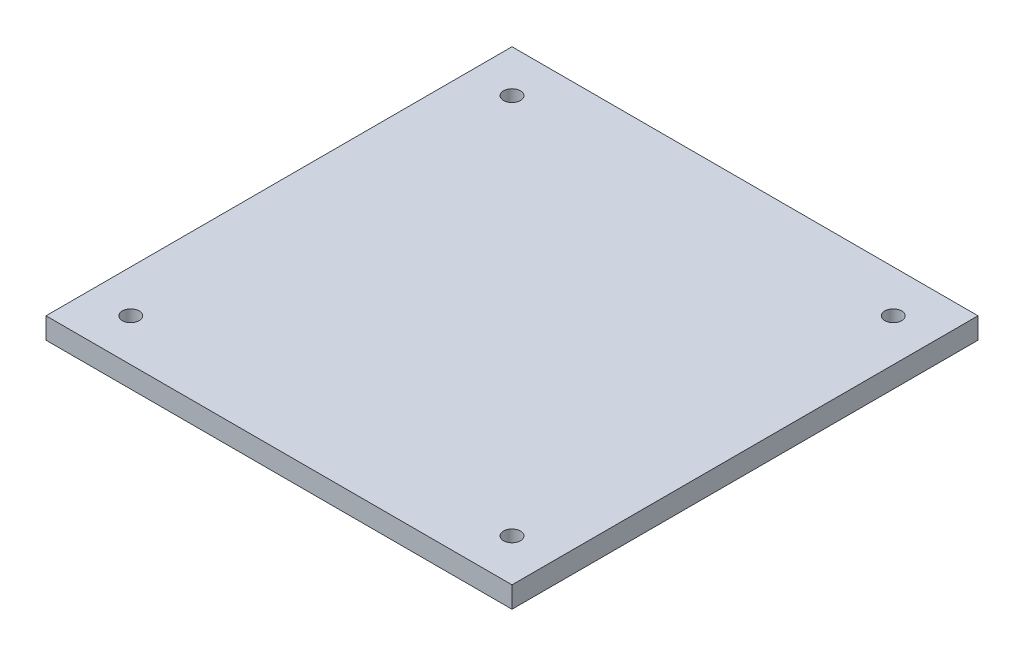
from build123d import *

# Parameters (mm, degrees)
ESBO_O1_W                = 220
ESBO_O1_H                = 220
RESSALTO_EXTRUS_O1_DEPTH = 10
ESBO_O2_R                = 4
CORTE_EXTRUS_O1_DEPTH    = 204.108392489


with BuildPart() as part:
    # Esboço1 → Ressalto-extrusão1 (new body)
    with BuildSketch(Plane(origin=(0, 0, 0), x_dir=(1, 0, 0), z_dir=(0, 1, 0))):
        with Locations((11.724137931, 52.284482759)):
            Rectangle(ESBO_O1_W, ESBO_O1_H)
    extrude(amount=RESSALTO_EXTRUS_O1_DEPTH)

    # Esboço2 → Corte-extrusão1 (cut, through all)
    with BuildSketch(Plane(origin=(0, 10, 0), x_dir=(1, 0, 0), z_dir=(0, 1, 0))):
        with Locations(Location((-78.275862069, 142.284482759, 0), (0, 0, 270))):
            Circle(ESBO_O2_R)
        with Locations(Location((101.724137931, 142.284482759, 0), (0, 0, 90))):
            Circle(ESBO_O2_R)
        with Locations(Location((101.724137931, -37.715517241, 0), (0, 0, 270))):
            Circle(ESBO_O2_R)
        with Locations(Location((-78.275862069, -37.715517241, 0), (0, 0, 90))):
            Circle(ESBO_O2_R)
    extrude(amount=-CORTE_EXTRUS_O1_DEPTH, mode=Mode.SUBTRACT)


solid = part.part
